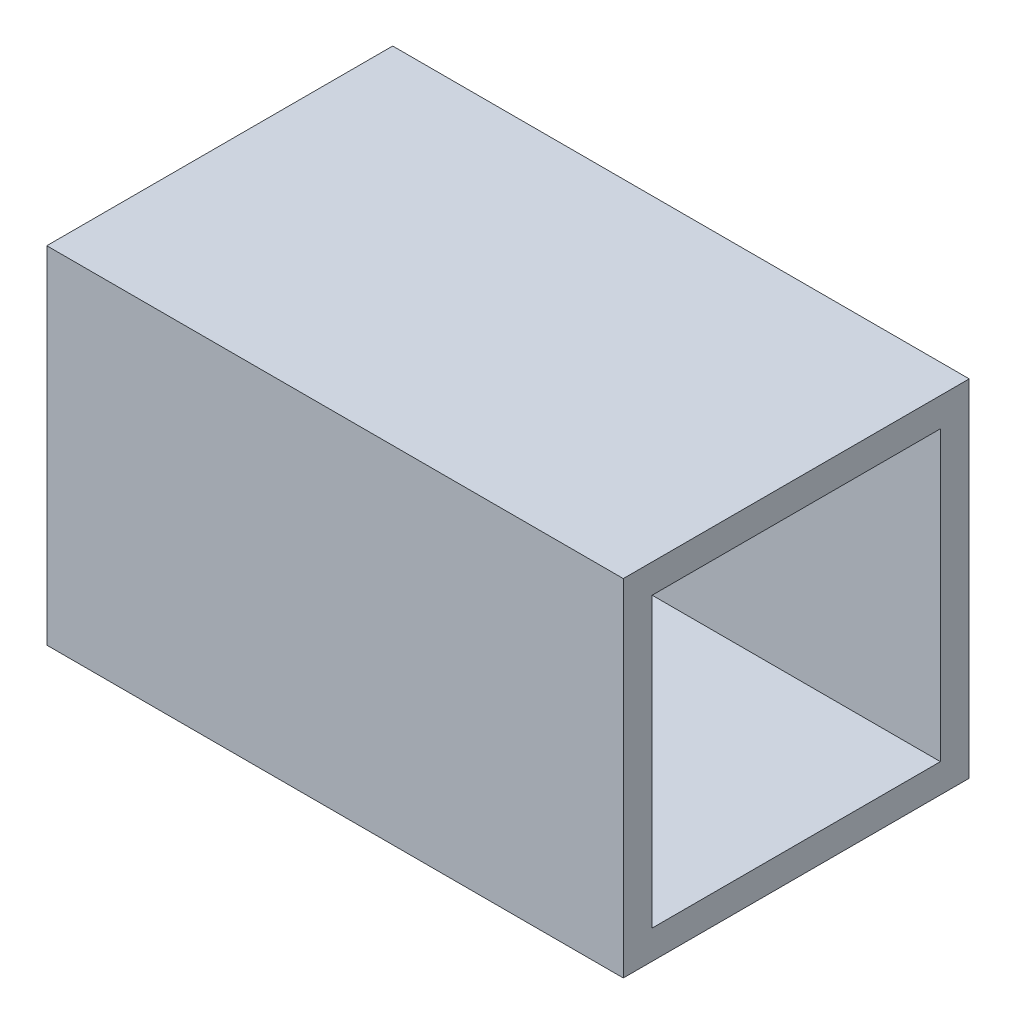
from build123d import *

# Parameters (mm, degrees)
SKETCH1_W           = 24
SKETCH1_H           = 24
SKETCH1_W_2         = 20
SKETCH1_H_2         = 20
BOSS_EXTRUDE1_DEPTH = 40
SKETCH2_R           = 5
BOSS_EXTRUDE2_DEPTH = 7


with BuildPart() as part:
    # Sketch1 → Boss-Extrude1 (new body)
    with BuildSketch(Plane(origin=(0, 0, 0), x_dir=(0, 0, -1), z_dir=(1, 0, 0))):
        Rectangle(SKETCH1_W, SKETCH1_H)
        Rectangle(SKETCH1_W_2, SKETCH1_H_2, mode=Mode.SUBTRACT)
    extrude(amount=BOSS_EXTRUDE1_DEPTH)

    # Sketch2 → Boss-Extrude2 (add)
    with BuildSketch(Plane(origin=(0, 0, -12), x_dir=(-1, 0, 0), z_dir=(0, 0, -1))):
        with Locations(Location((-20, 0, 0), (0, 0, 90))):
            Circle(SKETCH2_R)
    extrude(amount=BOSS_EXTRUDE2_DEPTH)


solid = part.part
